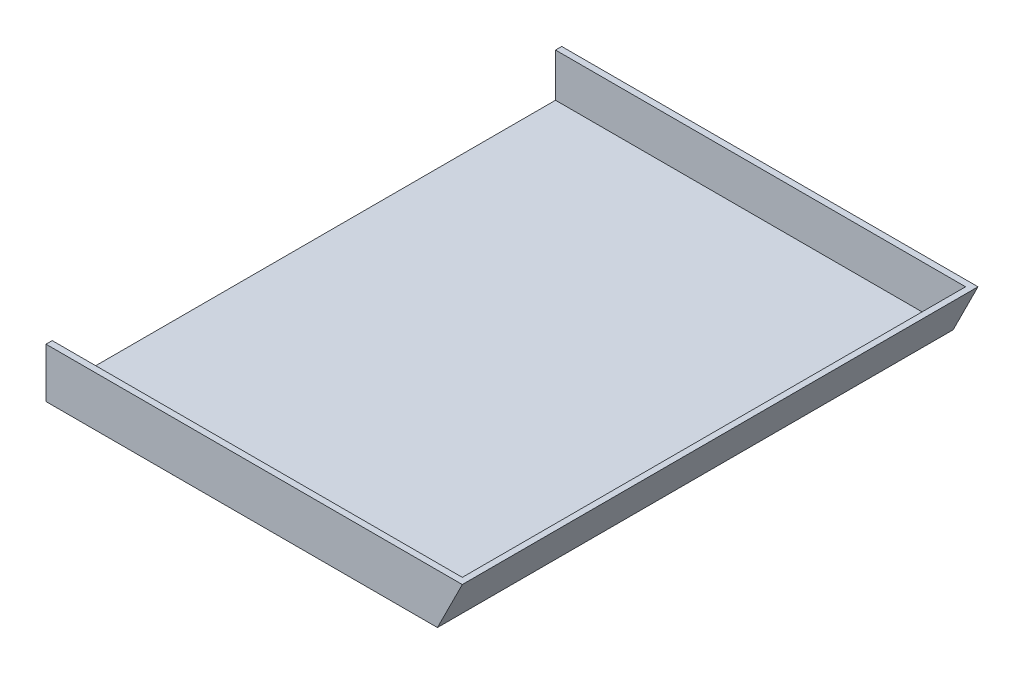
from build123d import *

# Parameters (mm, degrees)
SKETCH_2_R          = 1.5
EXTRUDE_1_DEPTH     = 83
SKETCH_3_W          = 62.5
SKETCH_3_H          = 1
SKETCH_3_W_2        = 4.5
SKETCH_3_W_3        = 67
EXTRUDE_2_DEPTH     = 7
CUT_EXTRUDE_1_DEPTH = 83
SKETCH_5_W          = 6.8
SKETCH_5_H          = 16.9
CUT_EXTRUDE_2_DEPTH = 79
SKETCH_7_W          = 6.8
SKETCH_7_H          = 7
EXTRUDE_3_DEPTH     = 38.5
SKETCH_8_W          = 6.8
SKETCH_8_H          = 7
CUT_EXTRUDE_3_DEPTH = 32
SKETCH_9_W          = 5.5
SKETCH_9_H          = 2.7
CUT_EXTRUDE_4_DEPTH = 7


with BuildPart() as part:
    # Эскиз2 → Бобышка-Вытянуть1 (new body)
    with BuildSketch(Plane.XY):
        with BuildLine():
            Line((29, 14.5), (32.5, 21.5))
            Line((32.5, 21.5), (33.5, 21.5))
            Line((33.5, 21.5), (29.5, 13.5))
            Line((29.5, 13.5), (3.4, 13.5))
            Line((3.4, 13.5), (3.4, 0))
            ThreePointArc((3.4, 0), (0, -3.4), (-3.4, 0))
            Line((-3.4, 0), (-3.4, 13.5))
            Line((-3.4, 13.5), (-33.5, 13.5))
            Line((-33.5, 13.5), (-33.5, 14.5))
            Line((-33.5, 14.5), (-32.5, 14.5))
            Line((-32.5, 14.5), (29, 14.5))
        make_face()
        Circle(SKETCH_2_R, mode=Mode.SUBTRACT)
    extrude(amount=EXTRUDE_1_DEPTH)

    # Эскиз3 → Бобышка-Вытянуть2 (add)
    with BuildSketch(Plane(origin=(0, 14.5, 0), x_dir=(1, 0, 0), z_dir=(0, 1, 0))):
        with Locations((-2.25, -82.5)):
            Rectangle(SKETCH_3_W, SKETCH_3_H)
        with Locations((31.25, -82.5)):
            Rectangle(SKETCH_3_W_2, SKETCH_3_H)
        with Locations((0, -0.5)):
            Rectangle(SKETCH_3_W_3, SKETCH_3_H)
    extrude(amount=EXTRUDE_2_DEPTH)

    # Эскиз4 → Вырез-Вытянуть1 (cut)
    with BuildSketch(Plane.XY.offset(83)):
        Polygon((29.5, 13.5), (33.5, 21.5), (33.5, 14.5), align=None)
    extrude(amount=-CUT_EXTRUDE_1_DEPTH, mode=Mode.SUBTRACT)

    # Эскиз5 → Вырез-Вытянуть2 (cut)
    with BuildSketch(Plane.XY.offset(83)):
        with Locations((0, 5.05)):
            Rectangle(SKETCH_5_W, SKETCH_5_H)
    extrude(amount=-CUT_EXTRUDE_2_DEPTH, mode=Mode.SUBTRACT)

    # Эскиз7 → Бобышка-Вытянуть3 (add)
    with BuildSketch(Plane.XY.offset(83)):
        with Locations((0, 10)):
            Rectangle(SKETCH_7_W, SKETCH_7_H)
    extrude(amount=-EXTRUDE_3_DEPTH)

    # Эскиз8 → Вырез-Вытянуть3 (cut)
    with BuildSketch(Plane.XY.offset(83)):
        with Locations((0, 10)):
            Rectangle(SKETCH_8_W, SKETCH_8_H)
    extrude(amount=-CUT_EXTRUDE_3_DEPTH, mode=Mode.SUBTRACT)

    # Эскиз9 → Вырез-Вытянуть4 (cut)
    with BuildSketch(Plane.XZ.offset(-6.5)):
        with Locations((0, 47.75)):
            Rectangle(SKETCH_9_W, SKETCH_9_H)
    extrude(amount=-CUT_EXTRUDE_4_DEPTH, mode=Mode.SUBTRACT)


solid = part.part
